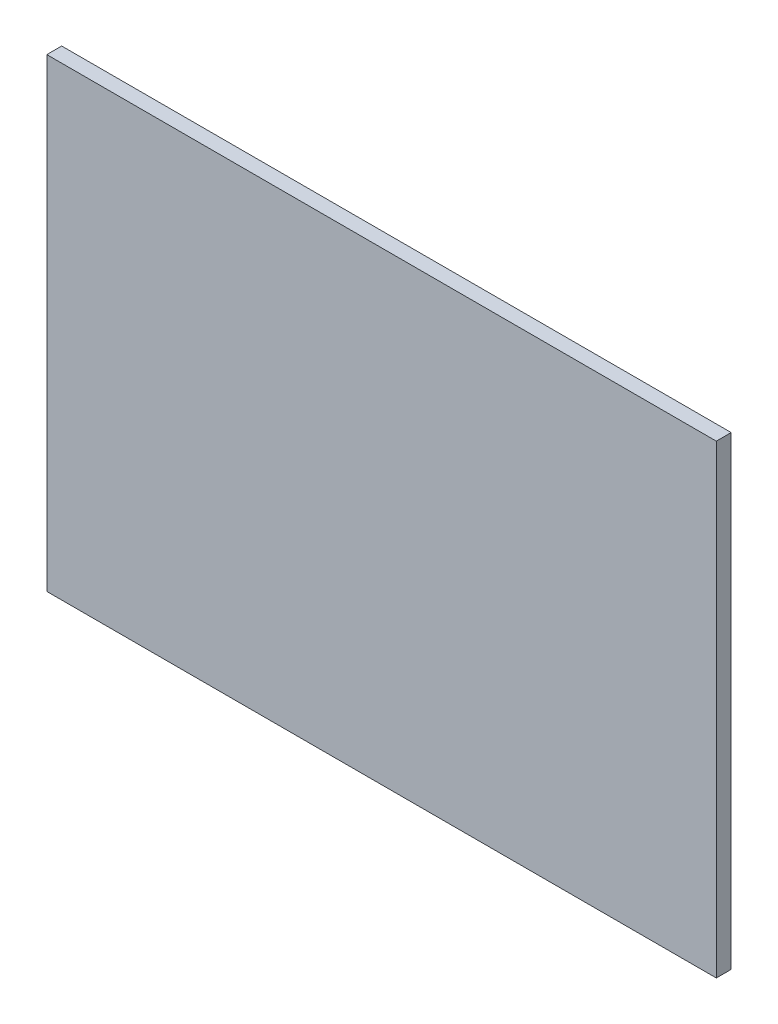
from build123d import *

# Parameters (mm, degrees)
SALIENTE_EXTRUIR1_DEPTH      = 2
SALIENTE_EXTRUIR1_DEPTH_BACK = 2
CROQUIS1_W                   = 180
CROQUIS1_H                   = 125


with BuildPart() as part:
    # Croquis1 → Saliente-Extruir1 (new, two sides: drawn at the far end of the back side and taken through both)
    with BuildSketch(Plane.XY.offset(-SALIENTE_EXTRUIR1_DEPTH_BACK)):
        Rectangle(CROQUIS1_W, CROQUIS1_H)
    extrude(amount=SALIENTE_EXTRUIR1_DEPTH + SALIENTE_EXTRUIR1_DEPTH_BACK)


solid = part.part
